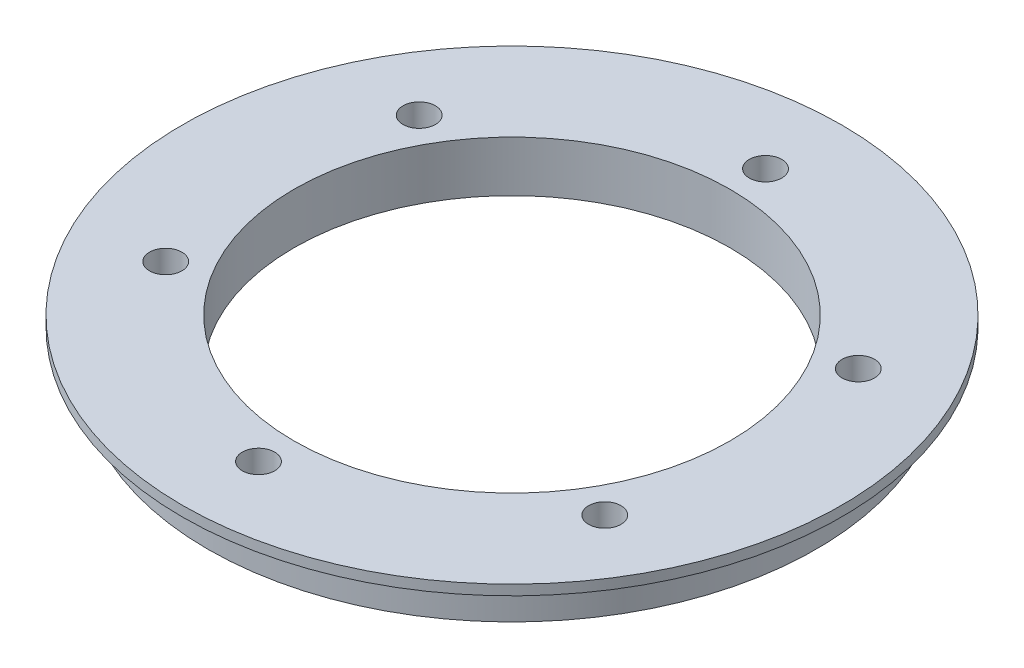
from build123d import *

# Parameters (mm, degrees)
SKETCH1_R           = 30
BOSS_EXTRUDE1_DEPTH = 5
SKETCH2_R           = 32.5
BOSS_EXTRUDE2_DEPTH = 1
SKETCH3_R           = 21.5
CUT_EXTRUDE1_DEPTH  = 25
SKETCH4_R           = 1.6
CUT_EXTRUDE2_DEPTH  = 25


with BuildPart() as part:
    # Sketch1 → Boss-Extrude1 (new body)
    with BuildSketch(Plane(origin=(0, 0, 0), x_dir=(1, 0, 0), z_dir=(0, 1, 0))):
        with Locations(Location((0, 0, 0), (0, 0, 270))):
            Circle(SKETCH1_R)
    extrude(amount=BOSS_EXTRUDE1_DEPTH)

    # Sketch2 → Boss-Extrude2 (add)
    with BuildSketch(Plane(origin=(0, 5, 0), x_dir=(1, 0, 0), z_dir=(0, 1, 0))):
        with Locations(Location((0, 0, 0), (0, 0, 270))):
            Circle(SKETCH2_R)
    extrude(amount=-BOSS_EXTRUDE2_DEPTH)

    # Sketch3 → Cut-Extrude1 (cut)
    with BuildSketch(Plane.XZ):
        with Locations(Location((0, 0, 0), (0, 0, 270))):
            Circle(SKETCH3_R)
    extrude(amount=-CUT_EXTRUDE1_DEPTH, mode=Mode.SUBTRACT)

    # Sketch4 → Cut-Extrude2 (cut)
    with BuildSketch(Plane(origin=(0, 5, 0), x_dir=(1, 0, 0), z_dir=(0, 1, 0))):
        with Locations(Location((0, 25, 0), (0, 0, 270))):
            Circle(SKETCH4_R)
        with Locations(Location((21.650635095, 12.5, 0), (0, 0, 270))):
            Circle(SKETCH4_R)
        with Locations(Location((21.650635095, -12.5, 0), (0, 0, 270))):
            Circle(SKETCH4_R)
        with Locations(Location((0, -25, 0), (0, 0, 270))):
            Circle(SKETCH4_R)
        with Locations(Location((-21.650635095, -12.5, 0), (0, 0, 270))):
            Circle(SKETCH4_R)
        with Locations(Location((-21.650635095, 12.5, 0), (0, 0, 270))):
            Circle(SKETCH4_R)
    extrude(amount=-CUT_EXTRUDE2_DEPTH, mode=Mode.SUBTRACT)


solid = part.part
